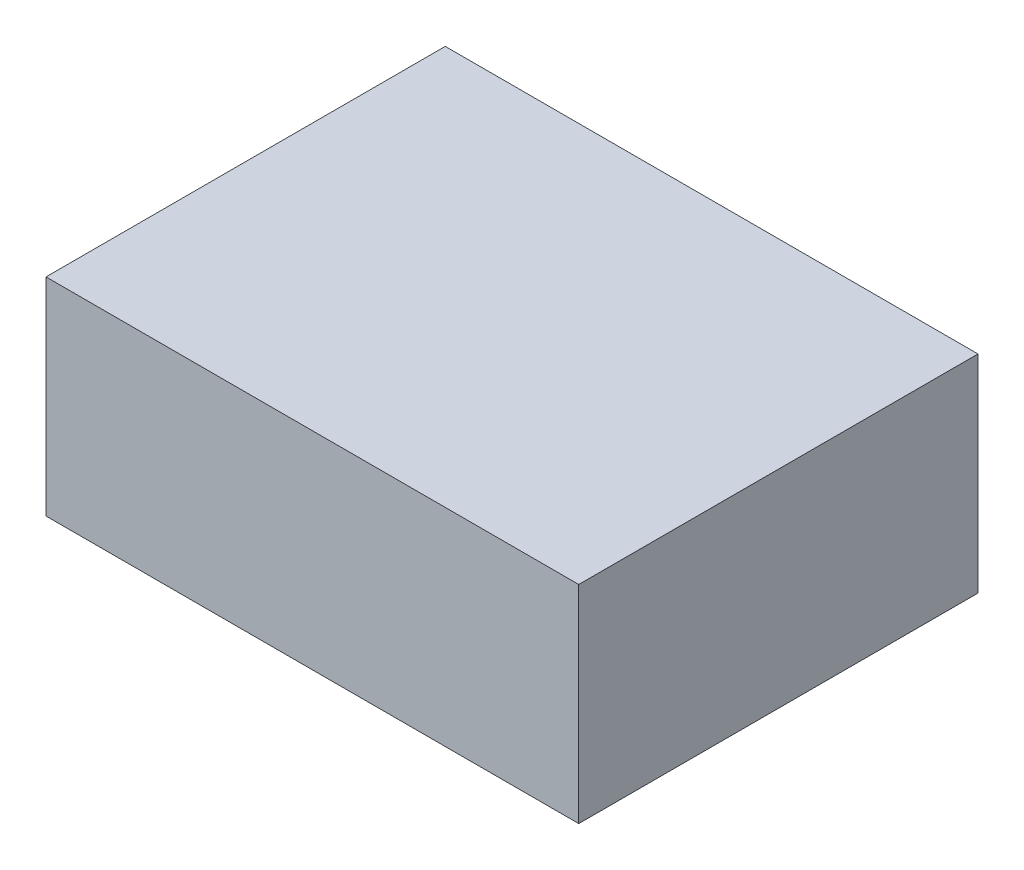
from build123d import *

# Parameters (mm, degrees)
SKETCH1_W      = 46.3
SKETCH1_H      = 18
ENVELOPE_DEPTH = 34.7


with BuildPart() as part:
    # Sketch1 → Envelope (new body)
    with BuildSketch(Plane.XY):
        Rectangle(SKETCH1_W, SKETCH1_H)
    extrude(amount=ENVELOPE_DEPTH)


solid = part.part
